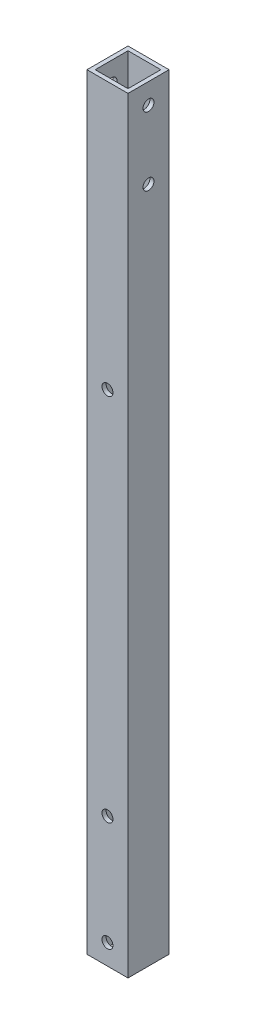
from build123d import *

# Parameters (mm, degrees)
SKETCH_1_W          = 15
SKETCH_1_H          = 15
SKETCH_1_W_2        = 12
SKETCH_1_H_2        = 12
EXTRUDE_1_DEPTH     = 280
SKETCH_2_R          = 2
CUT_EXTRUDE_1_DEPTH = 281.501782526
SKETCH_3_R          = 2
CUT_EXTRUDE_2_DEPTH = 281.501782526


with BuildPart() as part:
    # ｽｹｯﾁ1 → 押し出し-薄板1 (new body)
    with BuildSketch(Plane(origin=(0, 0, 0), x_dir=(1, 0, 0), z_dir=(0, 1, 0))):
        Rectangle(SKETCH_1_W, SKETCH_1_H)
        Rectangle(SKETCH_1_W_2, SKETCH_1_H_2, mode=Mode.SUBTRACT)
    extrude(amount=EXTRUDE_1_DEPTH)

    # ｽｹｯﾁ2 → ｶｯﾄ - 押し出し1 (cut, through all)
    with BuildSketch(Plane(origin=(7.5, 0, 0), x_dir=(0, 0, -1), z_dir=(1, 0, 0))):
        with Locations((0, 272.5)):
            Circle(SKETCH_2_R)
        with Locations((0, 247.5)):
            Circle(SKETCH_2_R)
    extrude(amount=-CUT_EXTRUDE_1_DEPTH, mode=Mode.SUBTRACT)

    # ｽｹｯﾁ3 → ｶｯﾄ - 押し出し2 (cut, through all)
    with BuildSketch(Plane.XY.offset(7.5)):
        with Locations((0, 7.5)):
            Circle(SKETCH_3_R)
        with Locations((0, 47.5)):
            Circle(SKETCH_3_R)
        with Locations((0, 182.5)):
            Circle(SKETCH_3_R)
    extrude(amount=-CUT_EXTRUDE_2_DEPTH, mode=Mode.SUBTRACT)


solid = part.part
